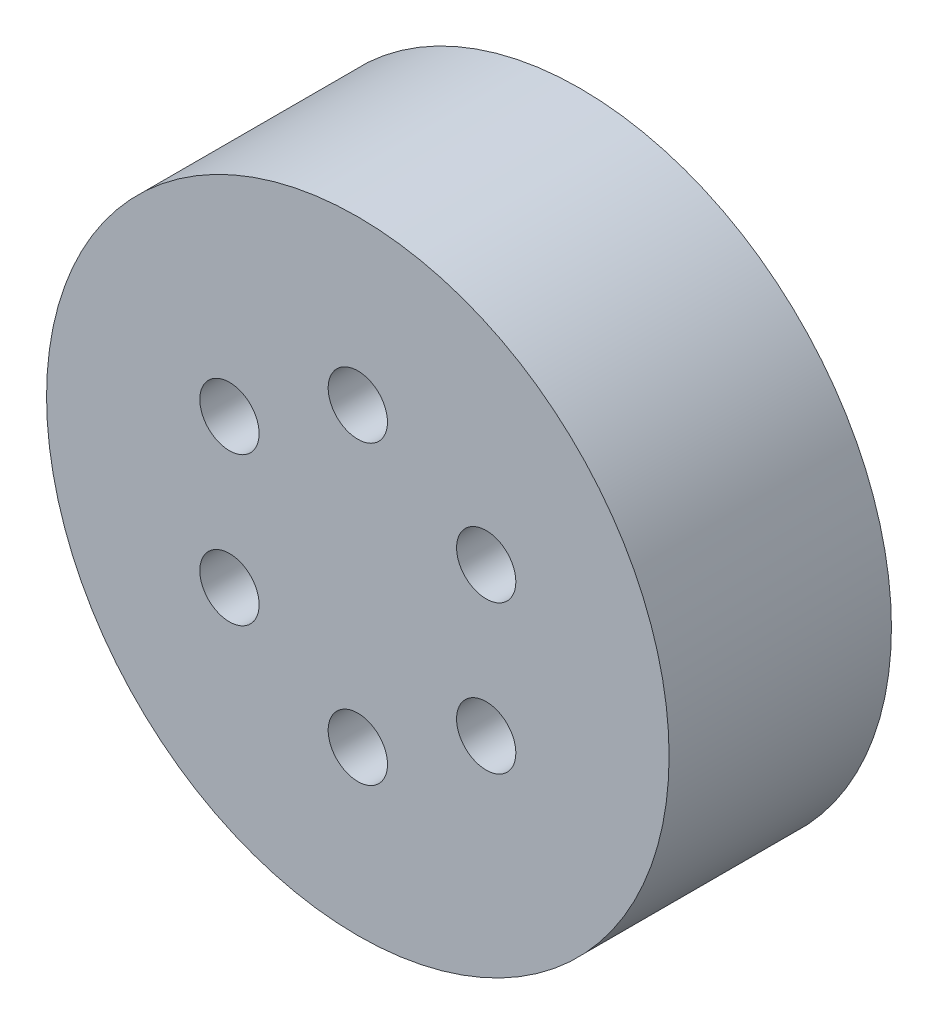
from build123d import *

# Parameters (mm, degrees)
SKETCH_1_R          = 21
EXTRUDE_1_DEPTH     = 15
SKETCH_2_R          = 2
CUT_EXTRUDE_1_DEPTH = 34.271609519


with BuildPart() as part:
    # 草图1 → 凸台-拉伸1 (new body)
    with BuildSketch(Plane.XY):
        Circle(SKETCH_1_R)
    extrude(amount=EXTRUDE_1_DEPTH)

    # 草图2 → 切除-拉伸1 (cut, through all)
    with BuildSketch(Plane.XY.offset(15)):
        with Locations((0, 10)):
            Circle(SKETCH_2_R)
        with Locations((8.660254038, 5)):
            Circle(SKETCH_2_R)
        with Locations((8.660254038, -5)):
            Circle(SKETCH_2_R)
        with Locations((0, -10)):
            Circle(SKETCH_2_R)
        with Locations((-8.660254038, -5)):
            Circle(SKETCH_2_R)
        with Locations((-8.660254038, 5)):
            Circle(SKETCH_2_R)
    extrude(amount=-CUT_EXTRUDE_1_DEPTH, mode=Mode.SUBTRACT)


solid = part.part
